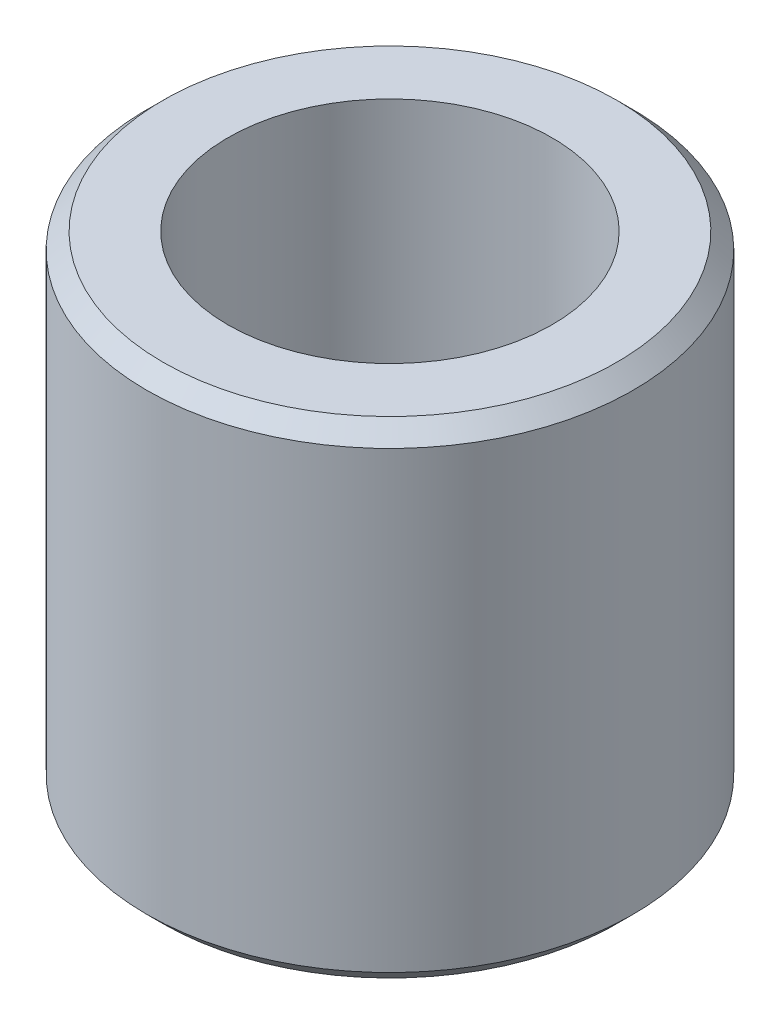
from build123d import *

# Parameters (mm, degrees)
SKETCH1_R           = 381
SKETCH1_R_2         = 254
BOSS_EXTRUDE1_DEPTH = 381
CHAMFER1_SIZE       = 25.4


with BuildPart() as part:
    # Sketch1 → Boss-Extrude1 (new, symmetric)
    with BuildSketch(Plane(origin=(0, 0, 0), x_dir=(1, 0, 0), z_dir=(0, 1, 0))):
        with Locations(Location((0, 0, 0), (0, 0, 270))):
            Circle(SKETCH1_R)
        with Locations(Location((0, 0, 0), (0, 0, 270))):
            Circle(SKETCH1_R_2, mode=Mode.SUBTRACT)
    extrude(amount=BOSS_EXTRUDE1_DEPTH, both=True)

    # Chamfer1
    chamfer1_edges = [part.edges().sort_by_distance(p)[0] for p in [
        (0, -381, -381),
        (0, 381, -381),
    ]]
    chamfer(chamfer1_edges, length=CHAMFER1_SIZE)


solid = part.part
